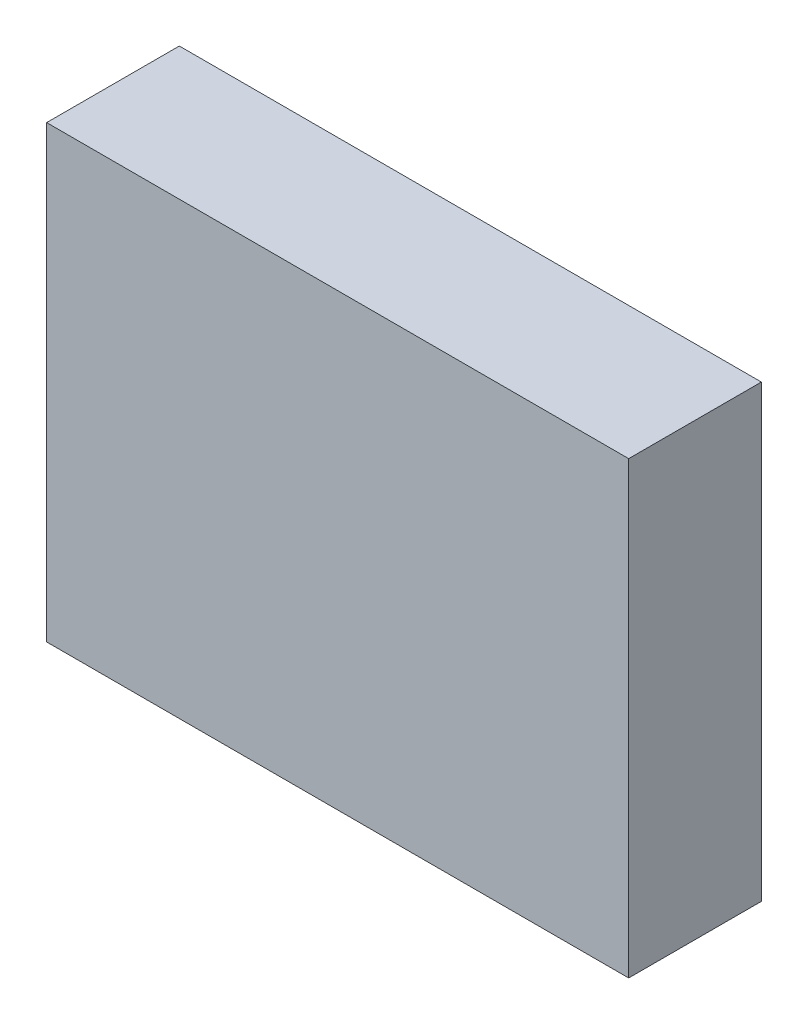
from build123d import *

# Parameters (mm, degrees)
SKETCH1_W           = 43.873957277
SKETCH1_H           = 33.905536156
BOSS_EXTRUDE1_DEPTH = 10


with BuildPart() as part:
    # Sketch1 → Boss-Extrude1 (new body)
    with BuildSketch(Plane.XY):
        with Locations((-50.246997169, 14.653122675)):
            Rectangle(SKETCH1_W, SKETCH1_H)
    extrude(amount=BOSS_EXTRUDE1_DEPTH)


solid = part.part
